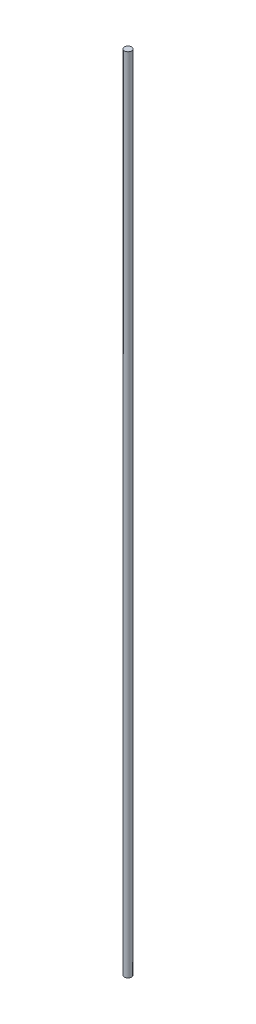
from build123d import *

# Parameters (mm, degrees)
SKETCH1_W = 0.75
SKETCH1_H = 170


with BuildPart() as part:
    # Sketch1 → Cuerdas_UHMWPE (revolve)
    with BuildSketch(Plane.XY, mode=Mode.PRIVATE) as cuerdas_uhmwpe_sk:
        with Locations((0.375, -121)):
            Rectangle(SKETCH1_W, SKETCH1_H)
    revolve(cuerdas_uhmwpe_sk.sketch.rotate(Axis((0, -210, 0), (0, 1, 0)), 90), axis=Axis((0, -210, 0), (0, 1, 0)))


solid = part.part
